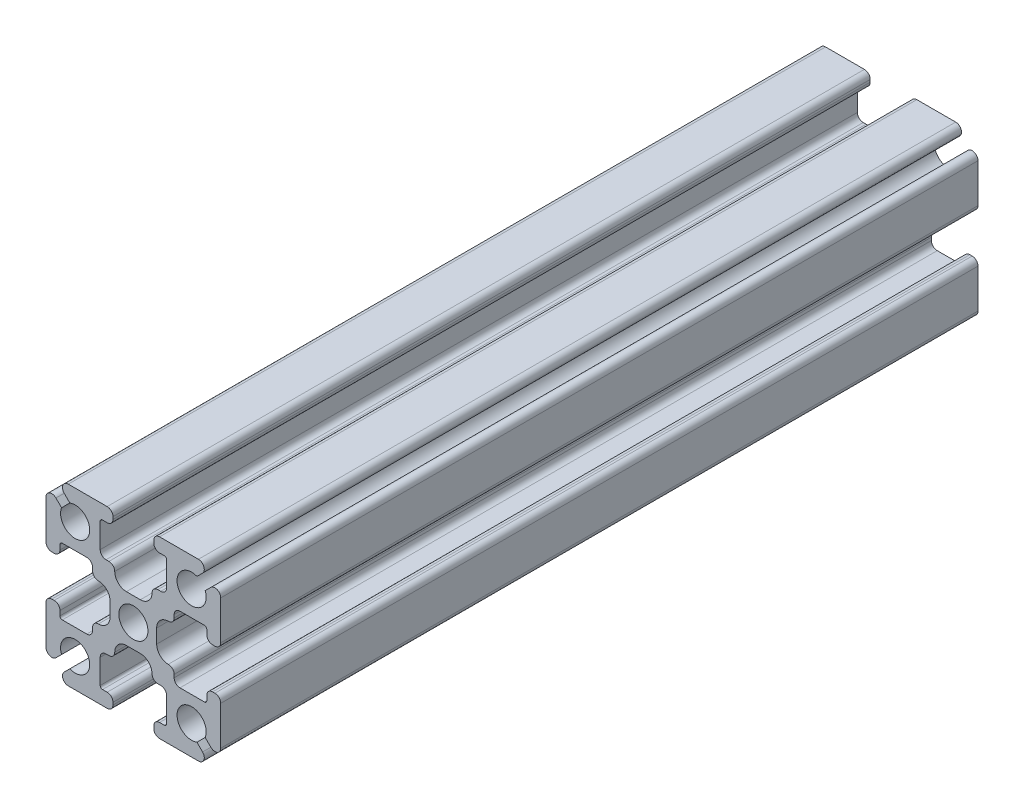
from build123d import *

# Parameters (mm, degrees)
SKETCH1_R           = 1.25
BOSS_EXTRUDE1_DEPTH = 65


with BuildPart() as part:
    # Sketch1 → Boss-Extrude1 (new body)
    with BuildSketch(Plane.XY):
        with BuildLine():
            Line((6.646446609, 5.939339828), (6.163645978, 5.456539197))
            ThreePointArc((6.163645978, 5.456539197), (4.116116524, 4.116116524), (5.456539197, 6.163645978))
            Line((5.456539197, 6.163645978), (5.939339828, 6.646446609))
            ThreePointArc((5.939339828, 6.646446609), (6.047726204, 7.191341716), (5.585786438, 7.5))
            Line((5.585786438, 7.5), (2.25, 7.5))
            ThreePointArc((2.25, 7.5), (1.896446609, 7.353553391), (1.75, 7))
            Line((1.75, 7), (1.75, 6.8))
            ThreePointArc((1.75, 6.8), (1.896446609, 6.446446609), (2.25, 6.3))
            Line((2.25, 6.3), (2.65, 6.3))
            ThreePointArc((2.65, 6.3), (2.791421356, 6.241421356), (2.85, 6.1))
            Line((2.85, 6.1), (2.85, 4))
            ThreePointArc((2.85, 4), (2.703553391, 3.646446609), (2.35, 3.5))
            Line((2.35, 3.5), (2.1, 3.5))
            ThreePointArc((2.1, 3.5), (1.746446609, 3.353553391), (1.6, 3))
            ThreePointArc((1.6, 3), (1.307106781, 2.292893219), (0.6, 2))
            Line((0.6, 2), (-0.6, 2))
            ThreePointArc((-0.6, 2), (-1.307106781, 2.292893219), (-1.6, 3))
            ThreePointArc((-1.6, 3), (-1.746446609, 3.353553391), (-2.1, 3.5))
            Line((-2.1, 3.5), (-2.35, 3.5))
            ThreePointArc((-2.35, 3.5), (-2.703553391, 3.646446609), (-2.85, 4))
            Line((-2.85, 4), (-2.85, 6.1))
            ThreePointArc((-2.85, 6.1), (-2.791421356, 6.241421356), (-2.65, 6.3))
            Line((-2.65, 6.3), (-2.25, 6.3))
            ThreePointArc((-2.25, 6.3), (-1.896446609, 6.446446609), (-1.75, 6.8))
            Line((-1.75, 6.8), (-1.75, 7))
            ThreePointArc((-1.75, 7), (-1.896446609, 7.353553391), (-2.25, 7.5))
            Line((-2.25, 7.5), (-5.585786438, 7.5))
            ThreePointArc((-5.585786438, 7.5), (-6.047726204, 7.191341716), (-5.939339828, 6.646446609))
            Line((-5.939339828, 6.646446609), (-5.456539197, 6.163645978))
            ThreePointArc((-5.456539197, 6.163645978), (-4.116116524, 4.116116524), (-6.163645978, 5.456539197))
            Line((-6.163645978, 5.456539197), (-6.646446609, 5.939339828))
            ThreePointArc((-6.646446609, 5.939339828), (-7.191341716, 6.047726204), (-7.5, 5.585786438))
            Line((-7.5, 5.585786438), (-7.5, 2.25))
            ThreePointArc((-7.5, 2.25), (-7.353553391, 1.896446609), (-7, 1.75))
            Line((-7, 1.75), (-6.8, 1.75))
            ThreePointArc((-6.8, 1.75), (-6.446446609, 1.896446609), (-6.3, 2.25))
            Line((-6.3, 2.25), (-6.3, 2.65))
            ThreePointArc((-6.3, 2.65), (-6.241421356, 2.791421356), (-6.1, 2.85))
            Line((-6.1, 2.85), (-4, 2.85))
            ThreePointArc((-4, 2.85), (-3.646446609, 2.703553391), (-3.5, 2.35))
            Line((-3.5, 2.35), (-3.5, 2.1))
            ThreePointArc((-3.5, 2.1), (-3.353553391, 1.746446609), (-3, 1.6))
            ThreePointArc((-3, 1.6), (-2.292893219, 1.307106781), (-2, 0.6))
            Line((-2, 0.6), (-2, -0.6))
            ThreePointArc((-2, -0.6), (-2.292893219, -1.307106781), (-3, -1.6))
            ThreePointArc((-3, -1.6), (-3.353553391, -1.746446609), (-3.5, -2.1))
            Line((-3.5, -2.1), (-3.5, -2.35))
            ThreePointArc((-3.5, -2.35), (-3.646446609, -2.703553391), (-4, -2.85))
            Line((-4, -2.85), (-6.1, -2.85))
            ThreePointArc((-6.1, -2.85), (-6.241421356, -2.791421356), (-6.3, -2.65))
            Line((-6.3, -2.65), (-6.3, -2.25))
            ThreePointArc((-6.3, -2.25), (-6.446446609, -1.896446609), (-6.8, -1.75))
            Line((-6.8, -1.75), (-7, -1.75))
            ThreePointArc((-7, -1.75), (-7.353553391, -1.896446609), (-7.5, -2.25))
            Line((-7.5, -2.25), (-7.5, -5.585786438))
            ThreePointArc((-7.5, -5.585786438), (-7.191341716, -6.047726204), (-6.646446609, -5.939339828))
            Line((-6.646446609, -5.939339828), (-6.163645978, -5.456539197))
            ThreePointArc((-6.163645978, -5.456539197), (-4.116116524, -4.116116524), (-5.456539197, -6.163645978))
            Line((-5.456539197, -6.163645978), (-5.939339828, -6.646446609))
            ThreePointArc((-5.939339828, -6.646446609), (-6.047726204, -7.191341716), (-5.585786438, -7.5))
            Line((-5.585786438, -7.5), (-2.25, -7.5))
            ThreePointArc((-2.25, -7.5), (-1.896446609, -7.353553391), (-1.75, -7))
            Line((-1.75, -7), (-1.75, -6.8))
            ThreePointArc((-1.75, -6.8), (-1.896446609, -6.446446609), (-2.25, -6.3))
            Line((-2.25, -6.3), (-2.65, -6.3))
            ThreePointArc((-2.65, -6.3), (-2.791421356, -6.241421356), (-2.85, -6.1))
            Line((-2.85, -6.1), (-2.85, -4))
            ThreePointArc((-2.85, -4), (-2.703553391, -3.646446609), (-2.35, -3.5))
            Line((-2.35, -3.5), (-2.1, -3.5))
            ThreePointArc((-2.1, -3.5), (-1.746446609, -3.353553391), (-1.6, -3))
            ThreePointArc((-1.6, -3), (-1.307106781, -2.292893219), (-0.6, -2))
            Line((-0.6, -2), (0.6, -2))
            ThreePointArc((0.6, -2), (1.307106781, -2.292893219), (1.6, -3))
            ThreePointArc((1.6, -3), (1.746446609, -3.353553391), (2.1, -3.5))
            Line((2.1, -3.5), (2.35, -3.5))
            ThreePointArc((2.35, -3.5), (2.703553391, -3.646446609), (2.85, -4))
            Line((2.85, -4), (2.85, -6.1))
            ThreePointArc((2.85, -6.1), (2.791421356, -6.241421356), (2.65, -6.3))
            Line((2.65, -6.3), (2.25, -6.3))
            ThreePointArc((2.25, -6.3), (1.896446609, -6.446446609), (1.75, -6.8))
            Line((1.75, -6.8), (1.75, -7))
            ThreePointArc((1.75, -7), (1.896446609, -7.353553391), (2.25, -7.5))
            Line((2.25, -7.5), (5.585786438, -7.5))
            ThreePointArc((5.585786438, -7.5), (6.047726204, -7.191341716), (5.939339828, -6.646446609))
            Line((5.939339828, -6.646446609), (5.456539197, -6.163645978))
            ThreePointArc((5.456539197, -6.163645978), (4.116116524, -4.116116524), (6.163645978, -5.456539197))
            Line((6.163645978, -5.456539197), (6.646446609, -5.939339828))
            ThreePointArc((6.646446609, -5.939339828), (7.191341716, -6.047726204), (7.5, -5.585786438))
            Line((7.5, -5.585786438), (7.5, -2.25))
            ThreePointArc((7.5, -2.25), (7.353553391, -1.896446609), (7, -1.75))
            Line((7, -1.75), (6.8, -1.75))
            ThreePointArc((6.8, -1.75), (6.446446609, -1.896446609), (6.3, -2.25))
            Line((6.3, -2.25), (6.3, -2.65))
            ThreePointArc((6.3, -2.65), (6.241421356, -2.791421356), (6.1, -2.85))
            Line((6.1, -2.85), (4, -2.85))
            ThreePointArc((4, -2.85), (3.646446609, -2.703553391), (3.5, -2.35))
            Line((3.5, -2.35), (3.5, -2.1))
            ThreePointArc((3.5, -2.1), (3.353553391, -1.746446609), (3, -1.6))
            ThreePointArc((3, -1.6), (2.292893219, -1.307106781), (2, -0.6))
            Line((2, -0.6), (2, 0.6))
            ThreePointArc((2, 0.6), (2.292893219, 1.307106781), (3, 1.6))
            ThreePointArc((3, 1.6), (3.353553391, 1.746446609), (3.5, 2.1))
            Line((3.5, 2.1), (3.5, 2.35))
            ThreePointArc((3.5, 2.35), (3.646446609, 2.703553391), (4, 2.85))
            Line((4, 2.85), (6.1, 2.85))
            ThreePointArc((6.1, 2.85), (6.241421356, 2.791421356), (6.3, 2.65))
            Line((6.3, 2.65), (6.3, 2.25))
            ThreePointArc((6.3, 2.25), (6.446446609, 1.896446609), (6.8, 1.75))
            Line((6.8, 1.75), (7, 1.75))
            ThreePointArc((7, 1.75), (7.353553391, 1.896446609), (7.5, 2.25))
            Line((7.5, 2.25), (7.5, 5.585786438))
            ThreePointArc((7.5, 5.585786438), (7.191341716, 6.047726204), (6.646446609, 5.939339828))
        make_face()
        with Locations(Location((0, 0, 0), (0, 0, 180))):
            Circle(SKETCH1_R, mode=Mode.SUBTRACT)
    extrude(amount=BOSS_EXTRUDE1_DEPTH)


solid = part.part
